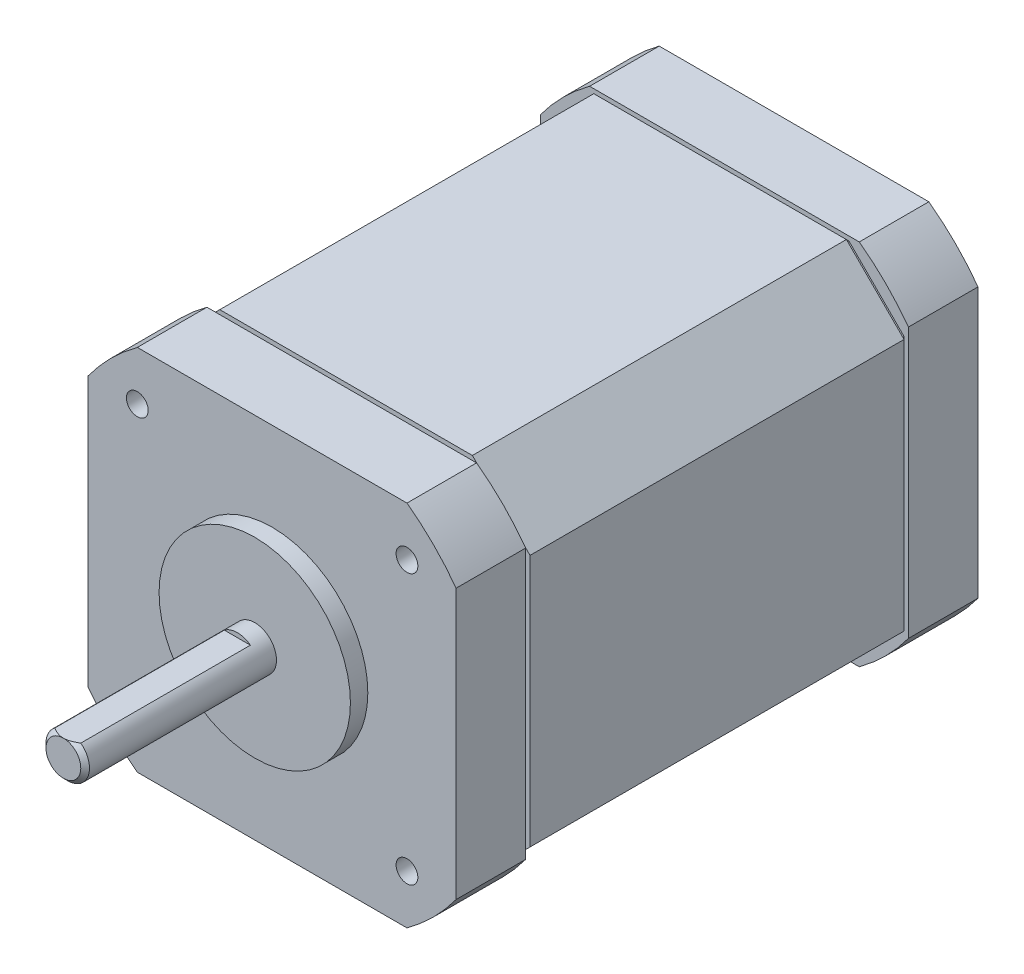
from build123d import *

# Parameters (mm, degrees)
SKETCH1_R           = 2.5
BOSS_EXTRUDE1_DEPTH = 22
SKETCH2_R           = 11
BOSS_EXTRUDE2_DEPTH = 2
BOSS_EXTRUDE3_DEPTH = 8
BOSS_EXTRUDE6_DEPTH = 0.5
BOSS_EXTRUDE4_DEPTH = 43
BOSS_EXTRUDE7_DEPTH = 0.5
BOSS_EXTRUDE5_DEPTH = 8
CHAMFER1_SIZE       = 0.5
SKETCH8_W           = 6.467116259
SKETCH8_H           = 1.343520631
CUT_EXTRUDE1_DEPTH  = 20
SKETCH9_R           = 1.25
CUT_EXTRUDE2_DEPTH  = 10


with BuildPart() as part:
    # Sketch1 → Boss-Extrude1 (new body)
    with BuildSketch(Plane.XY):
        Circle(SKETCH1_R)
    extrude(amount=-BOSS_EXTRUDE1_DEPTH)

    # Sketch2 → Boss-Extrude2 (add)
    with BuildSketch(Plane(origin=(0, 0, -22), x_dir=(-1, 0, 0), z_dir=(0, 0, -1))):
        Circle(SKETCH2_R)
    extrude(amount=BOSS_EXTRUDE2_DEPTH)

    # Sketch3 → Boss-Extrude3 (add)
    with BuildSketch(Plane(origin=(0, 0, -24), x_dir=(-1, 0, 0), z_dir=(0, 0, -1))):
        with BuildLine():
            Line((15.5, -21.15), (-15.5, -21.15))
            ThreePointArc((-15.5, -21.15), (-18.541473782, -18.541473782), (-21.15, -15.5))
            Line((-21.15, -15.5), (-21.15, 15.5))
            ThreePointArc((-21.15, 15.5), (-18.541473782, 18.541473782), (-15.5, 21.15))
            Line((-15.5, 21.15), (15.5, 21.15))
            ThreePointArc((15.5, 21.15), (18.541473782, 18.541473782), (21.15, 15.5))
            Line((21.15, 15.5), (21.15, -15.5))
            ThreePointArc((21.15, -15.5), (18.541473782, -18.541473782), (15.5, -21.15))
        make_face()
    extrude(amount=BOSS_EXTRUDE3_DEPTH)

    # Sketch6 → Boss-Extrude6 (add)
    with BuildSketch(Plane(origin=(0, 0, -32), x_dir=(-1, 0, 0), z_dir=(0, 0, -1))):
        Polygon((-20.65, -14.31162722), (-14.31162722, -20.65), (14.31162722, -20.65), (20.65, -14.31162722), (20.65, 14.31162722), (14.31162722, 20.65), (-14.31162722, 20.65), (-20.65, 14.31162722), align=None)
    extrude(amount=BOSS_EXTRUDE6_DEPTH)

    # Sketch4 → Boss-Extrude4 (add)
    with BuildSketch(Plane(origin=(0, 0, -32.5), x_dir=(-1, 0, 0), z_dir=(0, 0, -1))):
        Polygon((-21.15, 14.518734001), (-14.518734001, 21.15), (14.518734001, 21.15), (21.15, 14.518734001), (21.15, -14.518734001), (14.518734001, -21.15), (-14.518734001, -21.15), (-21.15, -14.518734001), align=None)
    extrude(amount=BOSS_EXTRUDE4_DEPTH)

    # Sketch7 → Boss-Extrude7 (add)
    with BuildSketch(Plane(origin=(0, 0, -75.5), x_dir=(-1, 0, 0), z_dir=(0, 0, -1))):
        Polygon((-20.65, -14.31162722), (-14.31162722, -20.65), (14.31162722, -20.65), (20.65, -14.31162722), (20.65, 14.31162722), (14.31162722, 20.65), (-14.31162722, 20.65), (-20.65, 14.31162722), align=None)
    extrude(amount=BOSS_EXTRUDE7_DEPTH)

    # Sketch5 → Boss-Extrude5 (add)
    with BuildSketch(Plane(origin=(0, 0, -76), x_dir=(-1, 0, 0), z_dir=(0, 0, -1))):
        with BuildLine():
            Line((-15.5, -21.15), (15.5, -21.15))
            ThreePointArc((15.5, -21.15), (18.541473782, -18.541473782), (21.15, -15.5))
            Line((21.15, -15.5), (21.15, 15.5))
            ThreePointArc((21.15, 15.5), (18.541473782, 18.541473782), (15.5, 21.15))
            Line((15.5, 21.15), (-15.5, 21.15))
            ThreePointArc((-15.5, 21.15), (-18.541473782, 18.541473782), (-21.15, 15.5))
            Line((-21.15, 15.5), (-21.15, -15.5))
            ThreePointArc((-21.15, -15.5), (-18.541473782, -18.541473782), (-15.5, -21.15))
        make_face()
    extrude(amount=BOSS_EXTRUDE5_DEPTH)

    # Chamfer1
    chamfer1_edges = [part.edges().sort_by_distance(p)[0] for p in [
        (-2.5, 0, 0),
    ]]
    chamfer(chamfer1_edges, length=CHAMFER1_SIZE)

    # Sketch8 → Cut-Extrude1 (cut)
    with BuildSketch(Plane.XY):
        with Locations((0.298403281, 2.671760316)):
            Rectangle(SKETCH8_W, SKETCH8_H)
    extrude(amount=-CUT_EXTRUDE1_DEPTH, mode=Mode.SUBTRACT)

    # Sketch9 → Cut-Extrude2 (cut)
    with BuildSketch(Plane.XY.offset(-24)):
        with Locations((-15.5, 15.5)):
            Circle(SKETCH9_R)
        with Locations((15.5, 15.5)):
            Circle(SKETCH9_R)
        with Locations((15.5, -15.5)):
            Circle(SKETCH9_R)
        with Locations((-15.5, -15.5)):
            Circle(SKETCH9_R)
    extrude(amount=-CUT_EXTRUDE2_DEPTH, mode=Mode.SUBTRACT)


solid = part.part
